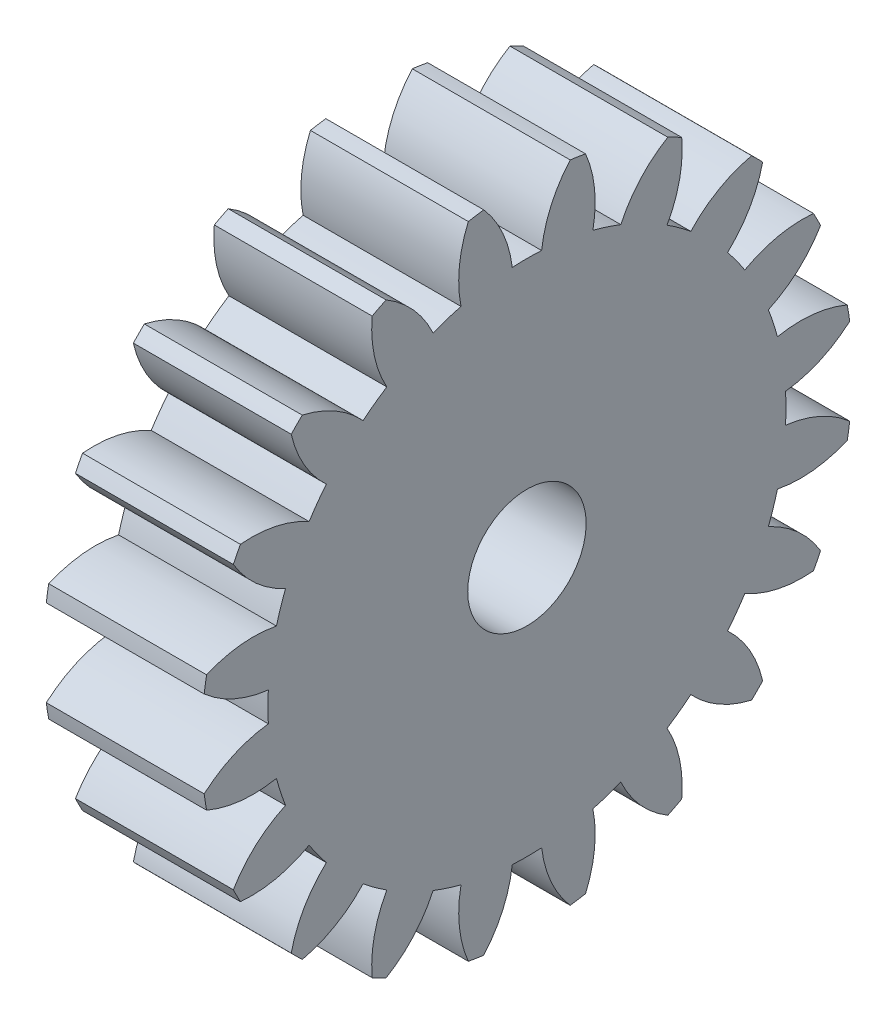
from build123d import *

# Parameters (mm, degrees)
BASPROSKE_W     = 8
BASPROSKE_H     = 16.5
TOOTHCUT_DEPTH  = 25.667792767
TEETHCUTS_COUNT = 20
TEETHCUTS_ANGLE = 342
BORSKE_R        = 3
BORE_DEPTH      = 50.0000508


with BuildPart() as part:
    # BasProSke → Base-Revolve (revolve)
    with BuildSketch(Plane(origin=(0, 0, 0), x_dir=(1, 0, 0), z_dir=(0, 1, 0)), mode=Mode.PRIVATE) as base_revolve_sk:
        with Locations((4, 8.25)):
            Rectangle(BASPROSKE_W, BASPROSKE_H)
    revolve(base_revolve_sk.sketch.rotate(Axis((-10, 0, 0), (1, 0, 0)), 180), axis=Axis((-10, 0, 0), (1, 0, 0)))

    # TooCutSke → ToothCut (cut, through all)
    with BuildSketch(Plane(origin=(0, 0, 0), x_dir=(0, 0, -1), z_dir=(1, 0, 0))):
        with BuildLine():
            ThreePointArc((0.74381438, 13.102904875), (0, 13.124), (-0.74381438, 13.102904875))
            ThreePointArc((-0.74381438, 13.102904875), (-1.226473103, 14.852072512), (-2.209965745, 16.376962373))
            ThreePointArc((-2.209965745, 16.376962373), (0, 16.5254), (2.209965745, 16.376962373))
            ThreePointArc((2.209965745, 16.376962373), (1.226473103, 14.852072512), (0.74381438, 13.102904875))
        make_face()
    toothcut = extrude(amount=TOOTHCUT_DEPTH, mode=Mode.SUBTRACT)

    # TeethCuts: ToothCut ×20 about axis
    teethcuts_axis = Axis((-10, 0, 0), (1, 0, 0))
    for i in range(1, TEETHCUTS_COUNT):
        add(toothcut.rotate(teethcuts_axis, i * TEETHCUTS_ANGLE / (TEETHCUTS_COUNT - 1)), mode=Mode.SUBTRACT)

    # BorSke → Bore (cut, symmetric)
    with BuildSketch(Plane(origin=(0, 0, 0), x_dir=(0, 0, -1), z_dir=(1, 0, 0))):
        with Locations(Location((0, 0, 0), (0, 0, 180))):
            Circle(BORSKE_R)
    extrude(amount=BORE_DEPTH, both=True, mode=Mode.SUBTRACT)


solid = part.part
